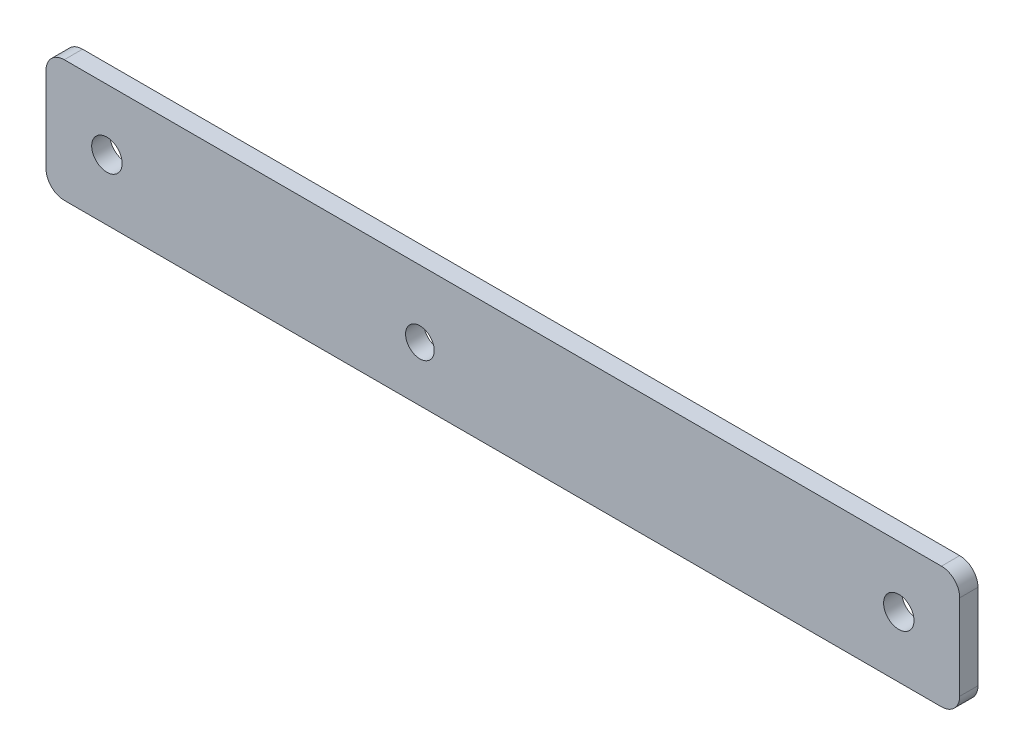
from build123d import *

# Parameters (mm, degrees)
SKETCH1_W           = 150
SKETCH1_H           = 20
SKETCH1_R           = 2.5
BOSS_EXTRUDE1_DEPTH = 3
FILLET1_R           = 3
SKETCH2_R           = 2.353501923
CUT_EXTRUDE1_DEPTH  = 108


with BuildPart() as part:
    # Sketch1 → Boss-Extrude1 (new body)
    with BuildSketch(Plane.XY):
        with Locations((35, 50)):
            Rectangle(SKETCH1_W, SKETCH1_H)
        with Locations((-30, 50)):
            Circle(SKETCH1_R, mode=Mode.SUBTRACT)
        with Locations((100, 50)):
            Circle(SKETCH1_R, mode=Mode.SUBTRACT)
    extrude(amount=BOSS_EXTRUDE1_DEPTH)

    # Fillet1
    fillet1_edges = [part.edges().sort_by_distance(p)[0] for p in [
        (110, 40, 1.5),
        (-40, 40, 1.5),
        (-40, 60, 1.5),
        (110, 60, 1.5),
    ]]
    fillet(fillet1_edges, radius=FILLET1_R)

    # Sketch2 → Cut-Extrude1 (cut)
    with BuildSketch(Plane.XY.offset(3)):
        with Locations((21.381283536, 49.013493537)):
            Circle(SKETCH2_R)
    extrude(amount=-CUT_EXTRUDE1_DEPTH, mode=Mode.SUBTRACT)


solid = part.part
